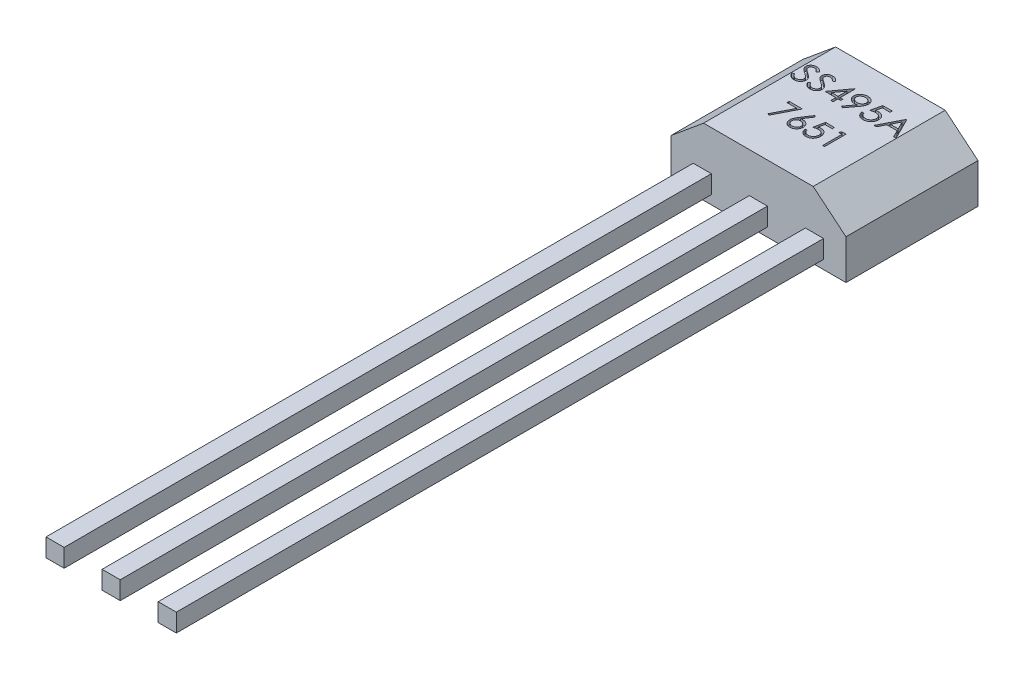
from build123d import *

# Parameters (mm, degrees)
BOSS_EXTRUDE1_DEPTH = 1.53
SKETCH2_W           = 0.42
SKETCH2_H           = 0.42
BOSS_EXTRUDE2_DEPTH = 15
CUT_EXTRUDE1_DEPTH  = 0.1


with BuildPart() as part:
    # Sketch1 → Boss-Extrude1 (new, symmetric)
    with BuildSketch(Plane.XY):
        Polygon((-2.03, 0.145), (-2.03, -0.775), (2.03, -0.775), (2.03, 0.145), (1.27, 0.775), (-1.27, 0.775), align=None)
    extrude(amount=BOSS_EXTRUDE1_DEPTH, both=True)

    # Sketch2 → Boss-Extrude2 (add)
    with BuildSketch(Plane.XY.offset(1.53)):
        with Locations((-1.3, -0.359384977)):
            Rectangle(SKETCH2_W, SKETCH2_H)
        with Locations((1.3, -0.359384977)):
            Rectangle(SKETCH2_W, SKETCH2_H)
        with Locations((0, -0.359384977)):
            Rectangle(SKETCH2_W, SKETCH2_H)
    extrude(amount=BOSS_EXTRUDE2_DEPTH)

    # Sketch3 → Cut-Extrude1 (cut)
    # profile 1 of 10: a face of its own
    with BuildSketch(Plane(origin=(0, 0.775, 0), x_dir=(1, 0, 0), z_dir=(0, 1, 0))):
        with BuildLine():
            Line((-1.257179487, 0.496454327), (-1.21140625, 0.521794872))
            add(Edge.make_bspline(
                [(-1.21140625, 0.521794872), (-1.20732253, 0.515200731), (-1.199466863, 0.502515881), (-1.186170961, 0.48556605), (-1.172554876, 0.471098031), (-1.158454487, 0.459159417), (-1.143742924, 0.449943454), (-1.12853663, 0.443315118), (-1.112797234, 0.439202897), (-1.102088672, 0.438709016), (-1.096722756, 0.438461538)],
                knots=[0, 0, 0, 0, 1.253021552, 2.410380904, 3.475470111, 4.460185, 5.388689421, 6.270994921, 7.133619014, 8, 8, 8, 8], degree=3))
            add(Edge.make_bspline(
                [(-1.096722756, 0.438461538), (-1.092139223, 0.438584378), (-1.083051394, 0.438827933), (-1.069688438, 0.441137276), (-1.056734529, 0.444722181), (-1.044432103, 0.449836081), (-1.032935103, 0.456037532), (-1.022781926, 0.463443084), (-1.014111896, 0.471876589), (-1.00699692, 0.481214706), (-1.00138844, 0.491210304), (-0.997355812, 0.501594114), (-0.994804387, 0.512290577), (-0.994508167, 0.51954394), (-0.994358974, 0.523197115)],
                knots=[0, 0, 0, 0, 1.117334146, 2.215352634, 3.29837511, 4.390456354, 5.45848967, 6.478319752, 7.445976648, 8.398987977, 9.332517181, 10.232504492, 11.109796257, 12, 12, 12, 12], degree=3))
            add(Edge.make_bspline(
                [(-0.994358974, 0.523197115), (-0.994606497, 0.527360088), (-0.995110016, 0.535828574), (-0.998791618, 0.548357985), (-1.004829449, 0.560725639), (-1.010389531, 0.5683167), (-1.013289263, 0.572275641)],
                knots=[0, 0, 0, 0, 0.931829012, 1.895563707, 2.902480149, 4, 4, 4, 4], degree=3))
            add(Edge.make_bspline(
                [(-1.013289263, 0.572275641), (-1.015659059, 0.575143386), (-1.020646987, 0.581179394), (-1.029239242, 0.590085202), (-1.039215267, 0.599387332), (-1.050480079, 0.609177939), (-1.063189901, 0.619262227), (-1.077100233, 0.629913518), (-1.092439682, 0.640924256), (-1.103247738, 0.648224494), (-1.108842147, 0.652003205)],
                knots=[0, 0, 0, 0, 0.714762393, 1.504426282, 2.375974636, 3.335718653, 4.371867423, 5.493494949, 6.702595789, 8, 8, 8, 8], degree=3))
            add(Edge.make_bspline(
                [(-1.108842147, 0.652003205), (-1.114404741, 0.655746602), (-1.125032619, 0.662898728), (-1.139901288, 0.673578131), (-1.153271842, 0.683218788), (-1.164911613, 0.692198773), (-1.174996699, 0.700201089), (-1.183412038, 0.70745489), (-1.190148651, 0.713900615), (-1.19390038, 0.718121373), (-1.195580929, 0.720012019)],
                knots=[0, 0, 0, 0, 1.456563732, 2.782907058, 3.976925193, 5.037437426, 5.976523114, 6.773507667, 7.450604967, 8, 8, 8, 8], degree=3))
            add(Edge.make_bspline(
                [(-1.195580929, 0.720012019), (-1.197930429, 0.722949558), (-1.202536631, 0.728708613), (-1.20855749, 0.737788383), (-1.213768947, 0.747014516), (-1.217762215, 0.756549051), (-1.221213073, 0.766130753), (-1.223490023, 0.775979072), (-1.224788077, 0.786016136), (-1.225014724, 0.792758114), (-1.225128205, 0.796133814)],
                knots=[0, 0, 0, 0, 1.082001755, 2.121268478, 3.131939468, 4.126079838, 5.092343318, 6.059513975, 7.028401166, 8, 8, 8, 8], degree=3))
            add(Edge.make_bspline(
                [(-1.225128205, 0.796133814), (-1.224913134, 0.801425066), (-1.224487135, 0.811905656), (-1.221185465, 0.827229539), (-1.215817437, 0.841823846), (-1.208402314, 0.855582058), (-1.198916908, 0.868230909), (-1.187689959, 0.879599191), (-1.174611765, 0.889406946), (-1.160084811, 0.897760297), (-1.144284294, 0.904394063), (-1.127724494, 0.909395077), (-1.110406604, 0.912204707), (-1.098668784, 0.912613306), (-1.092716346, 0.912820513)],
                knots=[0, 0, 0, 0, 0.967956048, 1.917268652, 2.855042101, 3.806653596, 4.767386207, 5.739731228, 6.721252043, 7.750674316, 8.799524247, 9.851450016, 10.91043571, 12, 12, 12, 12], degree=3))
            add(Edge.make_bspline(
                [(-1.092716346, 0.912820513), (-1.086391938, 0.912647768), (-1.073826744, 0.912304564), (-1.055381252, 0.908954653), (-1.037530747, 0.903726523), (-1.023187346, 0.897588032), (-1.011881325, 0.891534019), (-1.003328937, 0.885930864), (-0.994646302, 0.879491178), (-0.985712139, 0.872327488), (-0.976798301, 0.864149483), (-0.967782384, 0.855089741), (-0.958583249, 0.84521104), (-0.952567139, 0.838189859), (-0.949487179, 0.834595353)],
                knots=[0, 0, 0, 0, 1.343581969, 2.669398873, 3.972209689, 5.29212177, 5.978229007, 6.696944897, 7.463666474, 8.276335723, 9.130634109, 10.034185422, 10.993597435, 12, 12, 12, 12], degree=3))
            Line((-0.949487179, 0.834595353), (-0.993357372, 0.803846154))
            add(Edge.make_bspline(
                [(-0.993357372, 0.803846154), (-0.995949288, 0.806661954), (-1.000971669, 0.812118158), (-1.008448892, 0.819839381), (-1.015701089, 0.82674705), (-1.022564635, 0.833029847), (-1.029306113, 0.838363991), (-1.035587866, 0.843187607), (-1.041708604, 0.847037152), (-1.04930546, 0.85137314), (-1.05898752, 0.85544731), (-1.071010072, 0.858993053), (-1.083558403, 0.861141264), (-1.092107173, 0.861405224), (-1.096422276, 0.861538462)],
                knots=[0, 0, 0, 0, 1.1264946, 2.182819734, 3.162837221, 4.074442579, 4.920099024, 5.692522356, 6.404030606, 7.046419284, 8.265828538, 9.484802126, 10.730421381, 12, 12, 12, 12], degree=3))
            add(Edge.make_bspline(
                [(-1.096422276, 0.861538462), (-1.101886752, 0.861366224), (-1.112405578, 0.861034675), (-1.127340248, 0.857399832), (-1.14077134, 0.851685991), (-1.150505587, 0.844893922), (-1.157321186, 0.838696018), (-1.161662485, 0.833658766), (-1.165546458, 0.828526939), (-1.168513835, 0.82290933), (-1.170998941, 0.817142727), (-1.172504914, 0.811008532), (-1.17374061, 0.804729971), (-1.17381077, 0.800413889), (-1.173846154, 0.798237179)],
                knots=[0, 0, 0, 0, 1.760232571, 3.388353894, 4.927632624, 6.445876884, 7.19313098, 7.895540244, 8.589469407, 9.264487784, 9.940794775, 10.609853562, 11.298914165, 12, 12, 12, 12], degree=3))
            add(Edge.make_bspline(
                [(-1.173846154, 0.798237179), (-1.173743391, 0.795559994), (-1.17353777, 0.790203124), (-1.172066321, 0.78224323), (-1.169773399, 0.774364871), (-1.166389271, 0.766525001), (-1.161795464, 0.758538487), (-1.155572526, 0.750462071), (-1.14790549, 0.742019246), (-1.142070032, 0.736530491), (-1.138990385, 0.733633814)],
                knots=[0, 0, 0, 0, 0.847316756, 1.695424412, 2.55504833, 3.440604087, 4.39250749, 5.464392083, 6.661839371, 8, 8, 8, 8], degree=3))
            add(Edge.make_bspline(
                [(-1.138990385, 0.733633814), (-1.137829753, 0.732655726), (-1.135065515, 0.730326246), (-1.130018909, 0.726563195), (-1.123426123, 0.721810348), (-1.115300846, 0.716084289), (-1.10565944, 0.709313925), (-1.094413232, 0.701757907), (-1.081689265, 0.693100258), (-1.072655214, 0.687052933), (-1.067876603, 0.683854167)],
                knots=[0, 0, 0, 0, 0.419436643, 0.998958289, 1.739145775, 2.665983594, 3.746274523, 4.995278854, 6.410635948, 8, 8, 8, 8], degree=3))
            add(Edge.make_bspline(
                [(-1.067876603, 0.683854167), (-1.062110507, 0.679914618), (-1.050979183, 0.672309403), (-1.035201188, 0.660724676), (-1.020762094, 0.649554835), (-1.007759518, 0.638669026), (-0.996160886, 0.628143624), (-0.986025195, 0.617889274), (-0.977141422, 0.608055489), (-0.96977013, 0.598306688), (-0.963489636, 0.588779238), (-0.958053985, 0.579353963), (-0.953430611, 0.569919246), (-0.949590091, 0.560500671), (-0.946626625, 0.551023808), (-0.944719672, 0.541513059), (-0.943269011, 0.532021625), (-0.943140995, 0.525673315), (-0.943076923, 0.522495994)],
                knots=[0, 0, 0, 0, 1.578022906, 3.046339409, 4.422727009, 5.702703616, 6.8776146, 7.96063192, 8.960000702, 9.869926452, 10.719515136, 11.53742413, 12.327003532, 13.091975727, 13.834173186, 14.566643069, 15.282606682, 16, 16, 16, 16], degree=3))
            add(Edge.make_bspline(
                [(-0.943076923, 0.522495994), (-0.943206154, 0.518013012), (-0.943462211, 0.509130489), (-0.945673061, 0.496080434), (-0.949022447, 0.483410131), (-0.954038734, 0.471270308), (-0.96023456, 0.459480576), (-0.967917934, 0.448212743), (-0.977023729, 0.437453915), (-0.987326496, 0.427280875), (-0.998577645, 0.417870894), (-1.010597242, 0.409675671), (-1.02320754, 0.402656355), (-1.036472873, 0.397099817), (-1.050304233, 0.392632381), (-1.064721292, 0.389456292), (-1.079774126, 0.387482768), (-1.090005822, 0.387281873), (-1.095220353, 0.387179487)],
                knots=[0, 0, 0, 0, 0.951595583, 1.885479558, 2.80416064, 3.72995842, 4.668998158, 5.628881797, 6.620439808, 7.65848502, 8.700881629, 9.731609297, 10.744171855, 11.761046479, 12.781500572, 13.827629713, 14.892862811, 16, 16, 16, 16], degree=3))
            add(Edge.make_bspline(
                [(-1.095220353, 0.387179487), (-1.099263895, 0.38725004), (-1.107235673, 0.387389135), (-1.119035464, 0.388689384), (-1.130577545, 0.390494673), (-1.141795316, 0.393376529), (-1.152784049, 0.396873576), (-1.163483776, 0.401151699), (-1.17386304, 0.406336311), (-1.184014286, 0.412223365), (-1.19392711, 0.419123712), (-1.20360694, 0.4270201), (-1.213075864, 0.435997638), (-1.222253666, 0.446078032), (-1.231408329, 0.457094836), (-1.240286214, 0.469212788), (-1.248933056, 0.482412229), (-1.254381137, 0.491689271), (-1.257179487, 0.496454327)],
                knots=[0, 0, 0, 0, 0.9415657, 1.856281696, 2.762794391, 3.66065843, 4.551013359, 5.447866327, 6.341746891, 7.251456702, 8.179140589, 9.152078792, 10.158839414, 11.215634977, 12.32593623, 13.494135372, 14.712888492, 16, 16, 16, 16], degree=3))
        make_face()
    # profile 2 of 10: a face of its own
    with BuildSketch(Plane(origin=(0, 0.775, 0), x_dir=(1, 0, 0), z_dir=(0, 1, 0))):
        with BuildLine():
            Line((-0.885384615, 0.496454327), (-0.839611378, 0.521794872))
            add(Edge.make_bspline(
                [(-0.839611378, 0.521794872), (-0.835527658, 0.515200731), (-0.827671991, 0.502515881), (-0.814376089, 0.48556605), (-0.800760004, 0.471098031), (-0.786659615, 0.459159417), (-0.771948052, 0.449943454), (-0.756741758, 0.443315118), (-0.741002362, 0.439202897), (-0.7302938, 0.438709016), (-0.724927885, 0.438461538)],
                knots=[0, 0, 0, 0, 1.253021552, 2.410380904, 3.475470111, 4.460185, 5.388689421, 6.270994921, 7.133619014, 8, 8, 8, 8], degree=3))
            add(Edge.make_bspline(
                [(-0.724927885, 0.438461538), (-0.720344352, 0.438584378), (-0.711256522, 0.438827933), (-0.697893566, 0.441137276), (-0.684939657, 0.444722181), (-0.672637231, 0.449836081), (-0.661140231, 0.456037532), (-0.650987054, 0.463443084), (-0.642317025, 0.471876589), (-0.635202048, 0.481214706), (-0.629593569, 0.491210304), (-0.625560941, 0.501594114), (-0.623009515, 0.512290577), (-0.622713295, 0.51954394), (-0.622564103, 0.523197115)],
                knots=[0, 0, 0, 0, 1.117334146, 2.215352634, 3.29837511, 4.390456354, 5.45848967, 6.478319752, 7.445976648, 8.398987977, 9.332517181, 10.232504492, 11.109796257, 12, 12, 12, 12], degree=3))
            add(Edge.make_bspline(
                [(-0.622564103, 0.523197115), (-0.622811625, 0.527360088), (-0.623315145, 0.535828574), (-0.626996747, 0.548357985), (-0.633034577, 0.560725639), (-0.638594659, 0.5683167), (-0.641494391, 0.572275641)],
                knots=[0, 0, 0, 0, 0.931829012, 1.895563707, 2.902480149, 4, 4, 4, 4], degree=3))
            add(Edge.make_bspline(
                [(-0.641494391, 0.572275641), (-0.643864187, 0.575143386), (-0.648852116, 0.581179394), (-0.657444371, 0.590085202), (-0.667420396, 0.599387332), (-0.678685207, 0.609177939), (-0.691395029, 0.619262227), (-0.705305361, 0.629913518), (-0.72064481, 0.640924256), (-0.731452866, 0.648224494), (-0.737047276, 0.652003205)],
                knots=[0, 0, 0, 0, 0.714762393, 1.504426282, 2.375974636, 3.335718653, 4.371867423, 5.493494949, 6.702595789, 8, 8, 8, 8], degree=3))
            add(Edge.make_bspline(
                [(-0.737047276, 0.652003205), (-0.742609869, 0.655746602), (-0.753237748, 0.662898728), (-0.768106416, 0.673578131), (-0.78147697, 0.683218788), (-0.793116741, 0.692198773), (-0.803201827, 0.700201089), (-0.811617166, 0.70745489), (-0.818353779, 0.713900615), (-0.822105508, 0.718121373), (-0.823786058, 0.720012019)],
                knots=[0, 0, 0, 0, 1.456563732, 2.782907058, 3.976925193, 5.037437426, 5.976523114, 6.773507667, 7.450604967, 8, 8, 8, 8], degree=3))
            add(Edge.make_bspline(
                [(-0.823786058, 0.720012019), (-0.826135557, 0.722949558), (-0.83074176, 0.728708613), (-0.836762618, 0.737788383), (-0.841974075, 0.747014516), (-0.845967343, 0.756549051), (-0.849418201, 0.766130753), (-0.851695151, 0.775979072), (-0.852993205, 0.786016136), (-0.853219852, 0.792758114), (-0.853333333, 0.796133814)],
                knots=[0, 0, 0, 0, 1.082001755, 2.121268478, 3.131939468, 4.126079838, 5.092343318, 6.059513975, 7.028401166, 8, 8, 8, 8], degree=3))
            add(Edge.make_bspline(
                [(-0.853333333, 0.796133814), (-0.853118263, 0.801425066), (-0.852692263, 0.811905656), (-0.849390593, 0.827229539), (-0.844022565, 0.841823846), (-0.836607442, 0.855582058), (-0.827122037, 0.868230909), (-0.815895087, 0.879599191), (-0.802816894, 0.889406946), (-0.78828994, 0.897760297), (-0.772489422, 0.904394063), (-0.755929622, 0.909395077), (-0.738611732, 0.912204707), (-0.726873912, 0.912613306), (-0.720921474, 0.912820513)],
                knots=[0, 0, 0, 0, 0.967956048, 1.917268652, 2.855042101, 3.806653596, 4.767386207, 5.739731228, 6.721252043, 7.750674316, 8.799524247, 9.851450016, 10.91043571, 12, 12, 12, 12], degree=3))
            add(Edge.make_bspline(
                [(-0.720921474, 0.912820513), (-0.714597066, 0.912647768), (-0.702031873, 0.912304564), (-0.68358638, 0.908954653), (-0.665735876, 0.903726523), (-0.651392474, 0.897588032), (-0.640086453, 0.891534019), (-0.631534065, 0.885930864), (-0.622851431, 0.879491178), (-0.613917267, 0.872327488), (-0.605003429, 0.864149483), (-0.595987512, 0.855089741), (-0.586788377, 0.84521104), (-0.580772267, 0.838189859), (-0.577692308, 0.834595353)],
                knots=[0, 0, 0, 0, 1.343581969, 2.669398873, 3.972209689, 5.29212177, 5.978229007, 6.696944897, 7.463666474, 8.276335723, 9.130634109, 10.034185422, 10.993597435, 12, 12, 12, 12], degree=3))
            Line((-0.577692308, 0.834595353), (-0.6215625, 0.803846154))
            add(Edge.make_bspline(
                [(-0.6215625, 0.803846154), (-0.624154416, 0.806661954), (-0.629176797, 0.812118158), (-0.63665402, 0.819839381), (-0.643906217, 0.82674705), (-0.650769763, 0.833029847), (-0.657511242, 0.838363991), (-0.663792994, 0.843187607), (-0.669913733, 0.847037152), (-0.677510588, 0.85137314), (-0.687192648, 0.85544731), (-0.699215201, 0.858993053), (-0.711763531, 0.861141264), (-0.720312301, 0.861405224), (-0.724627404, 0.861538462)],
                knots=[0, 0, 0, 0, 1.1264946, 2.182819734, 3.162837221, 4.074442579, 4.920099024, 5.692522356, 6.404030606, 7.046419284, 8.265828538, 9.484802126, 10.730421381, 12, 12, 12, 12], degree=3))
            add(Edge.make_bspline(
                [(-0.724627404, 0.861538462), (-0.73009188, 0.861366224), (-0.740610706, 0.861034675), (-0.755545376, 0.857399832), (-0.768976468, 0.851685991), (-0.778710715, 0.844893922), (-0.785526314, 0.838696018), (-0.789867613, 0.833658766), (-0.793751586, 0.828526939), (-0.796718963, 0.82290933), (-0.79920407, 0.817142727), (-0.800710042, 0.811008532), (-0.801945738, 0.804729971), (-0.802015898, 0.800413889), (-0.802051282, 0.798237179)],
                knots=[0, 0, 0, 0, 1.760232571, 3.388353894, 4.927632624, 6.445876884, 7.19313098, 7.895540244, 8.589469407, 9.264487784, 9.940794775, 10.609853562, 11.298914165, 12, 12, 12, 12], degree=3))
            add(Edge.make_bspline(
                [(-0.802051282, 0.798237179), (-0.801948519, 0.795559994), (-0.801742898, 0.790203124), (-0.80027145, 0.78224323), (-0.797978528, 0.774364871), (-0.7945944, 0.766525001), (-0.790000593, 0.758538487), (-0.783777655, 0.750462071), (-0.776110618, 0.742019246), (-0.770275161, 0.736530491), (-0.767195513, 0.733633814)],
                knots=[0, 0, 0, 0, 0.847316756, 1.695424412, 2.55504833, 3.440604087, 4.39250749, 5.464392083, 6.661839371, 8, 8, 8, 8], degree=3))
            add(Edge.make_bspline(
                [(-0.767195513, 0.733633814), (-0.766034881, 0.732655726), (-0.763270643, 0.730326246), (-0.758224037, 0.726563195), (-0.751631251, 0.721810348), (-0.743505974, 0.716084289), (-0.733864568, 0.709313925), (-0.72261836, 0.701757907), (-0.709894393, 0.693100258), (-0.700860342, 0.687052933), (-0.696081731, 0.683854167)],
                knots=[0, 0, 0, 0, 0.419436643, 0.998958289, 1.739145775, 2.665983594, 3.746274523, 4.995278854, 6.410635948, 8, 8, 8, 8], degree=3))
            add(Edge.make_bspline(
                [(-0.696081731, 0.683854167), (-0.690315635, 0.679914618), (-0.679184311, 0.672309403), (-0.663406317, 0.660724676), (-0.648967223, 0.649554835), (-0.635964647, 0.638669026), (-0.624366014, 0.628143624), (-0.614230323, 0.617889274), (-0.60534655, 0.608055489), (-0.597975258, 0.598306688), (-0.591694765, 0.588779238), (-0.586259113, 0.579353963), (-0.581635739, 0.569919246), (-0.57779522, 0.560500671), (-0.574831753, 0.551023808), (-0.5729248, 0.541513059), (-0.57147414, 0.532021625), (-0.571346123, 0.525673315), (-0.571282051, 0.522495994)],
                knots=[0, 0, 0, 0, 1.578022906, 3.046339409, 4.422727009, 5.702703616, 6.8776146, 7.96063192, 8.960000702, 9.869926452, 10.719515136, 11.53742413, 12.327003532, 13.091975727, 13.834173186, 14.566643069, 15.282606682, 16, 16, 16, 16], degree=3))
            add(Edge.make_bspline(
                [(-0.571282051, 0.522495994), (-0.571411282, 0.518013012), (-0.571667339, 0.509130489), (-0.573878189, 0.496080434), (-0.577227575, 0.483410131), (-0.582243862, 0.471270308), (-0.588439688, 0.459480576), (-0.596123062, 0.448212743), (-0.605228857, 0.437453915), (-0.615531624, 0.427280875), (-0.626782773, 0.417870894), (-0.638802371, 0.409675671), (-0.651412669, 0.402656355), (-0.664678001, 0.397099817), (-0.678509361, 0.392632381), (-0.69292642, 0.389456292), (-0.707979254, 0.387482768), (-0.71821095, 0.387281873), (-0.723425481, 0.387179487)],
                knots=[0, 0, 0, 0, 0.951595583, 1.885479558, 2.80416064, 3.72995842, 4.668998158, 5.628881797, 6.620439808, 7.65848502, 8.700881629, 9.731609297, 10.744171855, 11.761046479, 12.781500572, 13.827629713, 14.892862811, 16, 16, 16, 16], degree=3))
            add(Edge.make_bspline(
                [(-0.723425481, 0.387179487), (-0.727469023, 0.38725004), (-0.735440801, 0.387389135), (-0.747240592, 0.388689384), (-0.758782673, 0.390494673), (-0.770000444, 0.393376529), (-0.780989178, 0.396873576), (-0.791688904, 0.401151699), (-0.802068168, 0.406336311), (-0.812219415, 0.412223365), (-0.822132238, 0.419123712), (-0.831812068, 0.4270201), (-0.841280992, 0.435997638), (-0.850458794, 0.446078032), (-0.859613457, 0.457094836), (-0.868491342, 0.469212788), (-0.877138184, 0.482412229), (-0.882586265, 0.491689271), (-0.885384615, 0.496454327)],
                knots=[0, 0, 0, 0, 0.9415657, 1.856281696, 2.762794391, 3.66065843, 4.551013359, 5.447866327, 6.341746891, 7.251456702, 8.179140589, 9.152078792, 10.158839414, 11.215634977, 12.32593623, 13.494135372, 14.712888492, 16, 16, 16, 16], degree=3))
        make_face()
    # profile 3 of 10: a face of its own
    with BuildSketch(Plane(origin=(0, 0.775, 0), x_dir=(1, 0, 0), z_dir=(0, 1, 0))):
        Polygon((-0.209903846, 0.912820513), (-0.199487179, 0.912820513), (-0.199487179, 0.566666667), (-0.135384615, 0.566666667), (-0.135384615, 0.515384615), (-0.199487179, 0.515384615), (-0.199487179, 0.4), (-0.250769231, 0.4), (-0.250769231, 0.515384615), (-0.500769231, 0.515384615), align=None)
        Polygon((-0.250769231, 0.566666667), (-0.250769231, 0.772596154), (-0.401410256, 0.566666667), align=None, mode=Mode.SUBTRACT)
    # profile 4 of 10: a face of its own
    with BuildSketch(Plane(origin=(0, 0.775, 0), x_dir=(1, 0, 0), z_dir=(0, 1, 0))):
        with BuildLine():
            Line((0.031282051, 0.387179487), (-0.011987179, 0.412620192))
            Line((-0.011987179, 0.412620192), (0.139655449, 0.616045673))
            add(Edge.make_bspline(
                [(0.139655449, 0.616045673), (0.130122064, 0.614718554), (0.111478781, 0.612123268), (0.092660806, 0.611730423), (0.083465545, 0.611538462)],
                knots=[0, 0, 0, 0, 1.022715214, 2, 2, 2, 2], degree=3))
            add(Edge.make_bspline(
                [(0.083465545, 0.611538462), (0.077950159, 0.611674043), (0.067116015, 0.611940372), (0.051199883, 0.614014924), (0.035890543, 0.61726924), (0.021218157, 0.622028965), (0.007152961, 0.628031141), (-0.006275147, 0.635398452), (-0.019006545, 0.644142414), (-0.030953654, 0.654125185), (-0.04189658, 0.665012941), (-0.051483825, 0.676676827), (-0.059571043, 0.689003198), (-0.06619627, 0.701928283), (-0.071353693, 0.715503128), (-0.075056139, 0.729666647), (-0.077326664, 0.744477755), (-0.077569215, 0.75455921), (-0.077692308, 0.759675481)],
                knots=[0, 0, 0, 0, 1.085275699, 2.131860764, 3.154001092, 4.161931336, 5.162875042, 6.159884903, 7.171514456, 8.198018286, 9.220306476, 10.205617798, 11.164338899, 12.116574216, 13.058779485, 14.016734527, 14.99350609, 16, 16, 16, 16], degree=3))
            add(Edge.make_bspline(
                [(-0.077692308, 0.759675481), (-0.077654772, 0.763218036), (-0.077580571, 0.770221074), (-0.076381019, 0.780550817), (-0.074718147, 0.790632075), (-0.072315049, 0.800445287), (-0.069183393, 0.810013339), (-0.06538758, 0.819328362), (-0.060867872, 0.828370532), (-0.053874016, 0.840006428), (-0.043691911, 0.853789452), (-0.028960977, 0.868570121), (-0.011876502, 0.881485389), (0.007164054, 0.892662047), (0.027769767, 0.901568556), (0.049315258, 0.908171411), (0.071639822, 0.912055372), (0.086756004, 0.91256392), (0.094383013, 0.912820513)],
                knots=[0, 0, 0, 0, 0.66263273, 1.309913963, 1.943754101, 2.5742279, 3.19866534, 3.82643929, 4.455207636, 5.088554753, 6.365809048, 7.651609901, 8.980141778, 10.363714386, 11.774175074, 13.171731459, 14.572970991, 16, 16, 16, 16], degree=3))
            add(Edge.make_bspline(
                [(0.094383013, 0.912820513), (0.101875848, 0.912557112), (0.116686839, 0.912036451), (0.138444159, 0.908291408), (0.159277015, 0.901892846), (0.179068364, 0.893109606), (0.197420783, 0.882097743), (0.213894822, 0.86892115), (0.228230899, 0.8536806), (0.240230074, 0.836585667), (0.250017877, 0.818322395), (0.256943338, 0.799160513), (0.261243673, 0.779363809), (0.261780644, 0.765940263), (0.262051282, 0.759174679)],
                knots=[0, 0, 0, 0, 1.065930497, 2.107011213, 3.130382208, 4.159723188, 5.180577042, 6.167335639, 7.152045129, 8.147207444, 9.131148852, 10.091445053, 11.038071829, 12, 12, 12, 12], degree=3))
            add(Edge.make_bspline(
                [(0.262051282, 0.759174679), (0.26185373, 0.753924861), (0.261452744, 0.74326887), (0.258884415, 0.72706575), (0.254358364, 0.710593593), (0.249430677, 0.696589516), (0.244390363, 0.685145323), (0.239956988, 0.675986917), (0.234889517, 0.666405584), (0.228974385, 0.65644402), (0.222542465, 0.645995176), (0.215359453, 0.63513117), (0.207583394, 0.623816391), (0.202009735, 0.616230859), (0.199150641, 0.612339744)],
                knots=[0, 0, 0, 0, 1.163091417, 2.36082311, 3.623822088, 4.943230279, 5.645390914, 6.392980924, 7.196979743, 8.045597714, 8.958946624, 9.914874294, 10.930402585, 12, 12, 12, 12], degree=3))
            Line((0.199150641, 0.612339744), (0.031282051, 0.387179487))
        make_face()
        with BuildLine():
            add(Edge.make_bspline(
                [(0.094182692, 0.662820513), (0.098292218, 0.662930842), (0.106331614, 0.663146676), (0.118137923, 0.664423426), (0.129396443, 0.666740173), (0.140130836, 0.669982572), (0.150422445, 0.673920915), (0.160073583, 0.67901584), (0.169226114, 0.684907176), (0.177702403, 0.691737057), (0.185428499, 0.699130944), (0.192210035, 0.707009866), (0.197980619, 0.715231812), (0.202607103, 0.723926662), (0.206226496, 0.732965208), (0.208837838, 0.742366044), (0.210519456, 0.752136449), (0.210685193, 0.758800476), (0.210769231, 0.762179487)],
                knots=[0, 0, 0, 0, 1.156350609, 2.262149552, 3.336172405, 4.385259037, 5.414433225, 6.431186485, 7.449933805, 8.472441869, 9.488891342, 10.454775422, 11.392853099, 12.30899303, 13.219529606, 14.126619466, 15.050098035, 16, 16, 16, 16], degree=3))
            add(Edge.make_bspline(
                [(0.210769231, 0.762179487), (0.210693855, 0.765559624), (0.210545075, 0.772231477), (0.208734771, 0.782000119), (0.206010331, 0.79139028), (0.202361648, 0.8004715), (0.197327957, 0.809051108), (0.191270476, 0.817260808), (0.184278602, 0.825226549), (0.176148742, 0.832556085), (0.167343364, 0.839297927), (0.1579754, 0.845262779), (0.148114301, 0.850289575), (0.137779432, 0.854389527), (0.126989582, 0.857611688), (0.115734917, 0.859937693), (0.103993964, 0.861203897), (0.096021745, 0.861425892), (0.091979167, 0.861538462)],
                knots=[0, 0, 0, 0, 0.942550442, 1.860445005, 2.763068889, 3.670061535, 4.584542428, 5.531598527, 6.51541433, 7.538026219, 8.581993866, 9.608548595, 10.634002551, 11.667305452, 12.708272946, 13.773983675, 14.87122457, 16, 16, 16, 16], degree=3))
            add(Edge.make_bspline(
                [(0.091979167, 0.861538462), (0.087970043, 0.861425615), (0.080064554, 0.861203095), (0.068421931, 0.859941162), (0.057240525, 0.857593119), (0.046503395, 0.854413457), (0.036221751, 0.850263365), (0.026382359, 0.845265997), (0.017015731, 0.83929716), (0.008210998, 0.83255586), (7.7318e-05, 0.825228138), (-0.006900673, 0.817255019), (-0.012997313, 0.809084878), (-0.017856643, 0.800416403), (-0.02168543, 0.791419434), (-0.024365613, 0.781995571), (-0.026188745, 0.772232657), (-0.02633577, 0.765560021), (-0.026410256, 0.762179487)],
                knots=[0, 0, 0, 0, 1.122085062, 2.212611316, 3.271668557, 4.315074561, 5.342123639, 6.369979763, 7.398939237, 8.445352421, 9.47035982, 10.456480252, 11.405754868, 12.317747928, 13.230458509, 14.135196827, 15.055241595, 16, 16, 16, 16], degree=3))
            add(Edge.make_bspline(
                [(-0.026410256, 0.762179487), (-0.026278792, 0.758802412), (-0.026019589, 0.752143965), (-0.024440202, 0.742330705), (-0.021532983, 0.732966593), (-0.017785199, 0.723857269), (-0.012673097, 0.715262854), (-0.006658553, 0.706928149), (0.000668353, 0.69917648), (0.008774687, 0.691653801), (0.017829113, 0.68496317), (0.027371292, 0.6790295), (0.037347181, 0.6739137), (0.047882807, 0.670021802), (0.058798032, 0.666719335), (0.070197797, 0.664436674), (0.082067193, 0.663152079), (0.090106486, 0.662932067), (0.094182692, 0.662820513)],
                knots=[0, 0, 0, 0, 0.935143193, 1.843784958, 2.741454899, 3.644390924, 4.563827145, 5.502935628, 6.484039941, 7.511127954, 8.561083157, 9.594679532, 10.61976948, 11.658271771, 12.699361952, 13.774242992, 14.871462427, 16, 16, 16, 16], degree=3))
        make_face(mode=Mode.SUBTRACT)
    # profile 5 of 10: a face of its own
    with BuildSketch(Plane(origin=(0, 0.775, 0), x_dir=(1, 0, 0), z_dir=(0, 1, 0))):
        with BuildLine():
            Line((0.672307692, 0.9), (0.672307692, 0.848717949))
            Line((0.672307692, 0.848717949), (0.495024038, 0.848717949))
            Line((0.495024038, 0.848717949), (0.46447516, 0.716606571))
            add(Edge.make_bspline(
                [(0.46447516, 0.716606571), (0.470031045, 0.718190893), (0.480796898, 0.721260895), (0.496746002, 0.724377668), (0.511821904, 0.726599954), (0.521625896, 0.726817645), (0.526374199, 0.726923077)],
                knots=[0, 0, 0, 0, 1.100584957, 2.132646227, 3.095596962, 4, 4, 4, 4], degree=3))
            add(Edge.make_bspline(
                [(0.526374199, 0.726923077), (0.532224208, 0.726801457), (0.543733649, 0.726562181), (0.560563072, 0.724292297), (0.576626189, 0.72069162), (0.591895025, 0.715676625), (0.606432131, 0.709268921), (0.620102181, 0.701249373), (0.633102474, 0.691959619), (0.645040638, 0.681126314), (0.65588555, 0.669277316), (0.665549176, 0.656613506), (0.673504284, 0.643005227), (0.680273522, 0.628717115), (0.685171606, 0.613460635), (0.688934869, 0.597499519), (0.691173601, 0.580685729), (0.691415271, 0.569210718), (0.691538462, 0.563361378)],
                knots=[0, 0, 0, 0, 1.077151714, 2.119212705, 3.121851832, 4.105966215, 5.075130764, 6.042439667, 7.020500988, 8.01341629, 9.005912455, 9.976422566, 10.941539175, 11.904595977, 12.882869982, 13.886885156, 14.922848286, 16, 16, 16, 16], degree=3))
            add(Edge.make_bspline(
                [(0.691538462, 0.563361378), (0.691452965, 0.559286034), (0.691283067, 0.551187512), (0.690182729, 0.539169688), (0.688267356, 0.527391627), (0.685580843, 0.515870454), (0.682038322, 0.504646237), (0.677837544, 0.493650955), (0.672777709, 0.482946971), (0.667150996, 0.472455597), (0.660719061, 0.462496456), (0.653819735, 0.453014863), (0.646276452, 0.444217983), (0.638253818, 0.435941952), (0.629614889, 0.428351301), (0.620472799, 0.421286823), (0.610742635, 0.41489534), (0.600500361, 0.409086187), (0.589830121, 0.403845372), (0.578637442, 0.39948498), (0.56714883, 0.395660191), (0.555211614, 0.392520021), (0.542859542, 0.390147559), (0.530080224, 0.388487044), (0.516948372, 0.387290405), (0.508047668, 0.387216789), (0.50353766, 0.387179487)],
                knots=[0, 0, 0, 0, 1.016499425, 2.019987615, 3.007067189, 3.990768755, 4.967927679, 5.940676635, 6.924201944, 7.919118939, 8.907813052, 9.878849546, 10.841710254, 11.795707484, 12.751447708, 13.707514388, 14.675260193, 15.652383633, 16.643074722, 17.637399078, 18.645988148, 19.661975783, 20.713747707, 21.780771562, 22.875511604, 24, 24, 24, 24], degree=3))
            add(Edge.make_bspline(
                [(0.50353766, 0.387179487), (0.498155614, 0.387277967), (0.487590088, 0.387471293), (0.472128267, 0.389492262), (0.45725727, 0.39242944), (0.443052574, 0.396766659), (0.429428631, 0.402246406), (0.416593064, 0.40916319), (0.404258457, 0.417073785), (0.392727908, 0.426278493), (0.382041076, 0.43641333), (0.372513348, 0.447447527), (0.363868239, 0.45901784), (0.35676009, 0.471564681), (0.350406636, 0.484613888), (0.345476242, 0.498510602), (0.341492964, 0.513070678), (0.339821945, 0.523111934), (0.338974359, 0.528205128)],
                knots=[0, 0, 0, 0, 1.085877747, 2.131692758, 3.142880474, 4.14286505, 5.125366391, 6.102257235, 7.081864604, 8.079734589, 9.076078377, 10.05059479, 11.019852918, 11.986271429, 12.957004748, 13.94627934, 14.958297804, 16, 16, 16, 16], degree=3))
            Line((0.338974359, 0.528205128), (0.39025641, 0.528205128))
            add(Edge.make_bspline(
                [(0.39025641, 0.528205128), (0.391428233, 0.523436128), (0.393682369, 0.51426241), (0.398528787, 0.501362966), (0.404531728, 0.489875169), (0.411728551, 0.479684398), (0.420210661, 0.470743943), (0.429942051, 0.462805947), (0.440866085, 0.45567232), (0.452963832, 0.449664635), (0.465733557, 0.444618765), (0.479096199, 0.441175243), (0.492704607, 0.438830724), (0.501925286, 0.438584722), (0.506542468, 0.438461538)],
                knots=[0, 0, 0, 0, 1.105255689, 2.126085831, 3.094714204, 4.016847766, 4.926388513, 5.861187163, 6.839282794, 7.858145028, 8.898395173, 9.925188997, 10.961054995, 12, 12, 12, 12], degree=3))
            add(Edge.make_bspline(
                [(0.506542468, 0.438461538), (0.511055737, 0.438577661), (0.519914684, 0.438805594), (0.532948083, 0.440586805), (0.545518145, 0.443322135), (0.557546012, 0.4474162), (0.569221384, 0.452390485), (0.580263972, 0.458749331), (0.590911837, 0.466124675), (0.600893325, 0.474552554), (0.610091784, 0.483798917), (0.618161599, 0.493758692), (0.624982185, 0.50431565), (0.630670232, 0.515391985), (0.634993067, 0.5270652), (0.637940354, 0.539310519), (0.639963747, 0.552076526), (0.640157689, 0.560815866), (0.64025641, 0.565264423)],
                knots=[0, 0, 0, 0, 1.055051283, 2.070925109, 3.071045655, 4.058623374, 5.037677312, 6.034164763, 7.032607791, 8.063255273, 9.08460474, 10.078366321, 11.055051477, 12.018762383, 12.984653025, 13.957962099, 14.960548061, 16, 16, 16, 16], degree=3))
            add(Edge.make_bspline(
                [(0.64025641, 0.565264423), (0.640183965, 0.569278152), (0.640041997, 0.577143745), (0.638229387, 0.588605439), (0.635583601, 0.599502414), (0.631730656, 0.609813857), (0.62679735, 0.619534007), (0.620874435, 0.628771546), (0.613688881, 0.637261348), (0.605570893, 0.645176676), (0.596609149, 0.652363909), (0.586823579, 0.658651694), (0.576212474, 0.663788024), (0.565014672, 0.668295793), (0.552992954, 0.671516624), (0.54031327, 0.673961413), (0.526871866, 0.675338382), (0.51766321, 0.675538606), (0.512952724, 0.675641026)],
                knots=[0, 0, 0, 0, 1.015670352, 1.990380851, 2.931800134, 3.852286557, 4.771295661, 5.688435274, 6.625018434, 7.581846215, 8.556520028, 9.530055911, 10.520920521, 11.538525318, 12.582836159, 13.667522609, 14.806872476, 16, 16, 16, 16], degree=3))
            add(Edge.make_bspline(
                [(0.512952724, 0.675641026), (0.50884342, 0.675560025), (0.500408039, 0.675393751), (0.487435951, 0.67411129), (0.473831596, 0.672110291), (0.459596633, 0.669282478), (0.444734564, 0.665644165), (0.429234245, 0.66123059), (0.413094395, 0.65602899), (0.402228902, 0.652041345), (0.396666667, 0.65)],
                knots=[0, 0, 0, 0, 0.823935763, 1.691335702, 2.611665863, 3.580679742, 4.600450859, 5.679197418, 6.811940615, 8, 8, 8, 8], degree=3))
            Line((0.396666667, 0.65), (0.454358974, 0.9))
            Line((0.454358974, 0.9), (0.672307692, 0.9))
        make_face()
    # profile 6 of 10: a face of its own
    with BuildSketch(Plane(origin=(0, 0.775, 0), x_dir=(1, 0, 0), z_dir=(0, 1, 0))):
        Polygon((1.012051282, 0.9), (1.262051282, 0.4), (1.205560897, 0.4), (1.125432692, 0.56025641), (0.888052885, 0.56025641), (0.805921474, 0.4), (0.749230769, 0.4), (1.005641026, 0.9), align=None)
        Polygon((1.008245192, 0.79463141), (0.914395032, 0.611538462), (1.099891827, 0.611538462), align=None, mode=Mode.SUBTRACT)
    # profile 7 of 10: a face of its own
    with BuildSketch(Plane(origin=(0, 0.775, 0), x_dir=(1, 0, 0), z_dir=(0, 1, 0))):
        Polygon((-0.717948718, -0.1), (-0.41025641, -0.1), (-0.673076923, -0.612820513), (-0.711838942, -0.591486378), (-0.486177885, -0.151282051), (-0.717948718, -0.151282051), align=None)
    # profile 8 of 10: a face of its own
    with BuildSketch(Plane(origin=(0, 0.775, 0), x_dir=(1, 0, 0), z_dir=(0, 1, 0))):
        with BuildLine():
            Line((-0.134615385, -0.087179487), (-0.100060096, -0.114322917))
            Line((-0.100060096, -0.114322917), (-0.232171474, -0.316346154))
            add(Edge.make_bspline(
                [(-0.232171474, -0.316346154), (-0.223375721, -0.314944174), (-0.206218608, -0.312209453), (-0.188852051, -0.311758318), (-0.180388622, -0.311538462)],
                knots=[0, 0, 0, 0, 1.025318673, 2, 2, 2, 2], degree=3))
            add(Edge.make_bspline(
                [(-0.180388622, -0.311538462), (-0.175306837, -0.311675049), (-0.165303494, -0.311943917), (-0.150616808, -0.314013039), (-0.136504103, -0.317273769), (-0.123023872, -0.322026948), (-0.110127732, -0.328098713), (-0.097741675, -0.335375695), (-0.086098531, -0.344233649), (-0.075048363, -0.354128643), (-0.06501592, -0.365088212), (-0.056133626, -0.376716974), (-0.048672656, -0.389002814), (-0.042619239, -0.40193951), (-0.037918542, -0.415507118), (-0.034491735, -0.429688281), (-0.032466079, -0.444492777), (-0.032191009, -0.454561088), (-0.032051282, -0.459675481)],
                knots=[0, 0, 0, 0, 1.04369286, 2.054478336, 3.041073146, 4.015093852, 4.984733326, 5.965804835, 6.960378782, 7.985147595, 9.009457201, 10.008161701, 10.986880575, 11.956520048, 12.937015923, 13.931873656, 14.949455224, 16, 16, 16, 16], degree=3))
            add(Edge.make_bspline(
                [(-0.032051282, -0.459675481), (-0.032254583, -0.466672581), (-0.03265463, -0.480441219), (-0.036640887, -0.500495035), (-0.042835122, -0.51959968), (-0.051689055, -0.537450133), (-0.062686538, -0.554021928), (-0.076097623, -0.568705566), (-0.091446692, -0.581801286), (-0.108801949, -0.592752231), (-0.127479515, -0.601695524), (-0.147101229, -0.60811913), (-0.167476536, -0.612073912), (-0.181305766, -0.612569712), (-0.188301282, -0.612820513)],
                knots=[0, 0, 0, 0, 1.031375318, 2.029502543, 3.004789286, 3.987476834, 4.960371455, 5.9300674, 6.912260825, 7.929083631, 8.949397511, 9.960523116, 10.96833055, 12, 12, 12, 12], degree=3))
            add(Edge.make_bspline(
                [(-0.188301282, -0.612820513), (-0.195029382, -0.612602198), (-0.20835657, -0.612169754), (-0.227961255, -0.608317477), (-0.246798829, -0.602073605), (-0.264737312, -0.593471565), (-0.281354543, -0.582606153), (-0.296221062, -0.569525828), (-0.309262744, -0.55451019), (-0.320116261, -0.537561569), (-0.328724652, -0.519348718), (-0.335180355, -0.500357695), (-0.338951247, -0.480657698), (-0.339478184, -0.46730325), (-0.33974359, -0.460576923)],
                knots=[0, 0, 0, 0, 1.012016664, 2.004627821, 2.994792927, 3.992885782, 4.990978636, 5.973936114, 6.964471063, 7.975201453, 8.993600317, 9.990122807, 10.98767138, 12, 12, 12, 12], degree=3))
            add(Edge.make_bspline(
                [(-0.33974359, -0.460576923), (-0.339574812, -0.455427697), (-0.3392302, -0.444913961), (-0.336824001, -0.428990528), (-0.332957602, -0.412697517), (-0.328627567, -0.398875489), (-0.32405248, -0.387552414), (-0.320244974, -0.378423344), (-0.315505832, -0.369028905), (-0.310452491, -0.359046957), (-0.304630082, -0.348734753), (-0.298299275, -0.337919943), (-0.291285039, -0.326774524), (-0.286367873, -0.319211068), (-0.283854167, -0.315344551)],
                knots=[0, 0, 0, 0, 1.173818275, 2.396712641, 3.66331629, 4.989737886, 5.693666774, 6.447286557, 7.243889047, 8.091586357, 8.998013824, 9.943181721, 10.948533338, 12, 12, 12, 12], degree=3))
            Line((-0.283854167, -0.315344551), (-0.134615385, -0.087179487))
        make_face()
        with BuildLine():
            add(Edge.make_bspline(
                [(-0.189803686, -0.362820513), (-0.193612578, -0.362931662), (-0.201052451, -0.363148768), (-0.211967796, -0.364409519), (-0.22229826, -0.366783671), (-0.232180708, -0.369807433), (-0.24143038, -0.373965013), (-0.2501145, -0.37901527), (-0.25826665, -0.384961152), (-0.265801443, -0.391718425), (-0.272632824, -0.399116716), (-0.278515842, -0.407040933), (-0.283590471, -0.415300105), (-0.287716445, -0.42396324), (-0.290929313, -0.433027025), (-0.293253349, -0.442449775), (-0.294546742, -0.452294676), (-0.294761918, -0.458970748), (-0.294871795, -0.462379808)],
                knots=[0, 0, 0, 0, 1.129588631, 2.206414736, 3.251139165, 4.268635594, 5.265702196, 6.250456724, 7.242448911, 8.251968645, 9.246821453, 10.222880186, 11.173611482, 12.116736599, 13.062300278, 14.020270554, 14.989073742, 16, 16, 16, 16], degree=3))
            add(Edge.make_bspline(
                [(-0.294871795, -0.462379808), (-0.294782315, -0.465758376), (-0.294606857, -0.472383246), (-0.293013669, -0.482145986), (-0.290580086, -0.491540973), (-0.286960029, -0.500519773), (-0.282641902, -0.509219247), (-0.276941142, -0.517324288), (-0.270624458, -0.525327155), (-0.263073896, -0.532613079), (-0.254970558, -0.539392597), (-0.246313244, -0.545318348), (-0.237290392, -0.550387801), (-0.227780189, -0.554360815), (-0.217917563, -0.557621427), (-0.207620341, -0.559915924), (-0.196881361, -0.561213142), (-0.189606799, -0.561428599), (-0.185897436, -0.561538462)],
                knots=[0, 0, 0, 0, 0.989467248, 1.94019797, 2.891935182, 3.827694429, 4.772920941, 5.730924762, 6.725747692, 7.756678648, 8.79901574, 9.819492441, 10.826891316, 11.826466727, 12.835195252, 13.867842842, 14.912794438, 16, 16, 16, 16], degree=3))
            add(Edge.make_bspline(
                [(-0.185897436, -0.561538462), (-0.182188079, -0.56142859), (-0.174913528, -0.561213117), (-0.164174463, -0.559916021), (-0.15387756, -0.557621072), (-0.144013773, -0.554362104), (-0.134507854, -0.550383017), (-0.125492894, -0.545349886), (-0.116917452, -0.539356155), (-0.108808795, -0.532624665), (-0.101289661, -0.525285686), (-0.094821478, -0.517395726), (-0.089295302, -0.509153741), (-0.084804704, -0.500554042), (-0.081224519, -0.491535544), (-0.078778596, -0.482147441), (-0.077188697, -0.472382865), (-0.077012788, -0.465758248), (-0.076923077, -0.462379808)],
                knots=[0, 0, 0, 0, 1.087397944, 2.132534446, 3.165364764, 4.174271784, 5.174024072, 6.181601208, 7.194203697, 8.236725232, 9.267838612, 10.269026844, 11.221737037, 12.171628256, 13.107553087, 14.05945871, 15.010357665, 16, 16, 16, 16], degree=3))
            add(Edge.make_bspline(
                [(-0.076923077, -0.462379808), (-0.07700169, -0.4589663), (-0.077155983, -0.452266696), (-0.078901118, -0.442454179), (-0.081321457, -0.432979149), (-0.084976176, -0.423901157), (-0.089724254, -0.415256024), (-0.095507598, -0.407000081), (-0.102197965, -0.399070032), (-0.109926185, -0.391703916), (-0.118339075, -0.384968619), (-0.127284159, -0.379022968), (-0.136642441, -0.374005115), (-0.146404433, -0.369818386), (-0.156681987, -0.366797032), (-0.167309179, -0.364417998), (-0.178421927, -0.363151995), (-0.185961443, -0.362932414), (-0.189803686, -0.362820513)],
                knots=[0, 0, 0, 0, 0.978206639, 1.919901502, 2.851605144, 3.780102724, 4.718870031, 5.675451981, 6.667674623, 7.690630536, 8.733308323, 9.756129687, 10.767539656, 11.776269907, 12.797430371, 13.836405707, 14.897401972, 16, 16, 16, 16], degree=3))
        make_face(mode=Mode.SUBTRACT)
    # profile 9 of 10: a face of its own
    with BuildSketch(Plane(origin=(0, 0.775, 0), x_dir=(1, 0, 0), z_dir=(0, 1, 0))):
        with BuildLine():
            Line((0.333333333, -0.1), (0.333333333, -0.151282051))
            Line((0.333333333, -0.151282051), (0.163261218, -0.151282051))
            Line((0.163261218, -0.151282051), (0.136318109, -0.282792468))
            add(Edge.make_bspline(
                [(0.136318109, -0.282792468), (0.141611805, -0.281331001), (0.151867505, -0.278499639), (0.167004628, -0.275355957), (0.181374942, -0.273460894), (0.190699995, -0.273202135), (0.19521234, -0.273076923)],
                knots=[0, 0, 0, 0, 1.100273476, 2.13160584, 3.095893838, 4, 4, 4, 4], degree=3))
            add(Edge.make_bspline(
                [(0.19521234, -0.273076923), (0.200795731, -0.273197771), (0.211774074, -0.273435388), (0.22783678, -0.275717081), (0.243170051, -0.279308497), (0.257741818, -0.284325715), (0.271579039, -0.290741391), (0.284554405, -0.298755668), (0.296862679, -0.308117573), (0.308283049, -0.318881146), (0.318643665, -0.330727091), (0.327753092, -0.34346393), (0.335490605, -0.356967882), (0.34171357, -0.371367968), (0.34668276, -0.38650499), (0.349990188, -0.402538216), (0.352192575, -0.419316519), (0.35243863, -0.430788601), (0.352564103, -0.436638622)],
                knots=[0, 0, 0, 0, 1.052922333, 2.070308379, 3.05430497, 4.020497103, 4.973039431, 5.925935799, 6.892292201, 7.88610001, 8.88166317, 9.857072816, 10.836096531, 11.812156883, 12.81219415, 13.836441305, 14.89672472, 16, 16, 16, 16], degree=3))
            add(Edge.make_bspline(
                [(0.352564103, -0.436638622), (0.352469092, -0.440713225), (0.352280354, -0.448807366), (0.351320556, -0.460827966), (0.349472597, -0.472594085), (0.346991493, -0.484107284), (0.343771148, -0.495345765), (0.339872711, -0.506341698), (0.33510185, -0.517026642), (0.329868797, -0.527501698), (0.323976443, -0.537530056), (0.317436656, -0.546908483), (0.3105273, -0.555777666), (0.303092817, -0.564042485), (0.295064103, -0.571648631), (0.286538393, -0.578641242), (0.277583719, -0.585138575), (0.268061542, -0.590876889), (0.258184044, -0.596157311), (0.247808585, -0.600489245), (0.237171342, -0.604362178), (0.226119217, -0.607449253), (0.214677243, -0.609868189), (0.202826561, -0.611511132), (0.190629323, -0.612707766), (0.182361464, -0.612782674), (0.178185096, -0.612820513)],
                knots=[0, 0, 0, 0, 1.056347294, 2.098418968, 3.122841568, 4.141288669, 5.149314143, 6.15115421, 7.162517403, 8.180376062, 9.185164535, 10.17417709, 11.141909838, 12.097768115, 13.052685741, 14.0056014, 14.954263652, 15.917497458, 16.885230207, 17.854509472, 18.828990115, 19.81800267, 20.826176721, 21.857883937, 22.917946725, 24, 24, 24, 24], degree=3))
            add(Edge.make_bspline(
                [(0.178185096, -0.612820513), (0.17320307, -0.612721822), (0.163401523, -0.612527659), (0.149041442, -0.610496446), (0.13522507, -0.607587315), (0.122063627, -0.603210705), (0.109439161, -0.597726806), (0.097521629, -0.590795925), (0.086006519, -0.582941767), (0.075361942, -0.573673145), (0.065482497, -0.563542333), (0.05663871, -0.552548385), (0.048762485, -0.54087275), (0.04197995, -0.528458728), (0.036194518, -0.515338938), (0.03164952, -0.501464223), (0.027981183, -0.48690708), (0.026429266, -0.47688515), (0.025641026, -0.471794872)],
                knots=[0, 0, 0, 0, 1.0467383, 2.05933395, 3.04377827, 4.011590433, 4.970194871, 5.932262533, 6.905835911, 7.896367577, 8.894135286, 9.877477877, 10.858688626, 11.851381753, 12.8477658, 13.868841284, 14.917554742, 16, 16, 16, 16], degree=3))
            Line((0.025641026, -0.471794872), (0.070512821, -0.471794872))
            add(Edge.make_bspline(
                [(0.070512821, -0.471794872), (0.0716169, -0.476562936), (0.073739002, -0.485727421), (0.078396967, -0.498603327), (0.084092092, -0.510077502), (0.090864141, -0.520301728), (0.098942717, -0.529217299), (0.108161207, -0.537162594), (0.118496596, -0.54433047), (0.129981343, -0.550305151), (0.142097497, -0.555400687), (0.154778527, -0.558793786), (0.167679148, -0.561179628), (0.17640463, -0.561418451), (0.180789263, -0.561538462)],
                knots=[0, 0, 0, 0, 1.136247022, 2.183929868, 3.172523383, 4.106158343, 5.02341133, 5.958108904, 6.928429099, 7.938127109, 8.96079061, 9.975095812, 10.982467395, 12, 12, 12, 12], degree=3))
            add(Edge.make_bspline(
                [(0.180789263, -0.561538462), (0.185069041, -0.561421208), (0.193495958, -0.561190333), (0.205897585, -0.559413332), (0.217870852, -0.556676536), (0.229297618, -0.552580842), (0.240377838, -0.547603025), (0.250831233, -0.541215157), (0.260960216, -0.533863726), (0.270449949, -0.52544135), (0.279141299, -0.516159966), (0.286820745, -0.506234624), (0.293217447, -0.495646503), (0.298608034, -0.484578909), (0.302701362, -0.472910544), (0.305621502, -0.460696091), (0.307336225, -0.447905379), (0.307572108, -0.439181192), (0.307692308, -0.434735577)],
                knots=[0, 0, 0, 0, 1.027316725, 2.022795036, 3.002884548, 3.971462791, 4.93288096, 5.914575861, 6.907176829, 7.935150275, 8.956128384, 9.956726525, 10.942570165, 11.921478529, 12.907843606, 13.90538589, 14.932640048, 16, 16, 16, 16], degree=3))
            add(Edge.make_bspline(
                [(0.307692308, -0.434735577), (0.307598239, -0.430724755), (0.307414114, -0.422874143), (0.305909746, -0.411388542), (0.303293036, -0.400520964), (0.299661053, -0.390218931), (0.295049695, -0.380472725), (0.289414507, -0.371272288), (0.282649736, -0.362738883), (0.274922324, -0.354868518), (0.266456889, -0.347604964), (0.257107783, -0.341412952), (0.247070651, -0.336203821), (0.236466422, -0.331708393), (0.225042865, -0.328479715), (0.213026204, -0.326055731), (0.200286674, -0.324653536), (0.191576575, -0.324458981), (0.187099359, -0.324358974)],
                knots=[0, 0, 0, 0, 1.045622112, 2.046656509, 3.013763289, 3.955457236, 4.890082067, 5.820317437, 6.762574623, 7.722996705, 8.69280354, 9.665887285, 10.63943826, 11.638615906, 12.663482002, 13.728887084, 14.832589034, 16, 16, 16, 16], degree=3))
            add(Edge.make_bspline(
                [(0.187099359, -0.324358974), (0.183223798, -0.324441916), (0.175221747, -0.324613169), (0.162947057, -0.325874097), (0.15004824, -0.327908282), (0.13657474, -0.330706318), (0.122486096, -0.3343679), (0.107812039, -0.338755686), (0.092521715, -0.344001686), (0.082219183, -0.347963431), (0.076923077, -0.35)],
                knots=[0, 0, 0, 0, 0.817624296, 1.688186739, 2.600797293, 3.572016777, 4.590301741, 5.671205678, 6.80286297, 8, 8, 8, 8], degree=3))
            Line((0.076923077, -0.35), (0.128205128, -0.1))
            Line((0.128205128, -0.1), (0.333333333, -0.1))
        make_face()
    # profile 10 of 10: a face of its own
    with BuildSketch(Plane(origin=(0, 0.775, 0), x_dir=(1, 0, 0), z_dir=(0, 1, 0))):
        Polygon((0.510116186, -0.1), (0.602564103, -0.1), (0.602564103, -0.6), (0.557692308, -0.6), (0.557692308, -0.151282051), (0.480769231, -0.151282051), align=None)
    extrude(amount=-CUT_EXTRUDE1_DEPTH, mode=Mode.SUBTRACT)


solid = part.part
